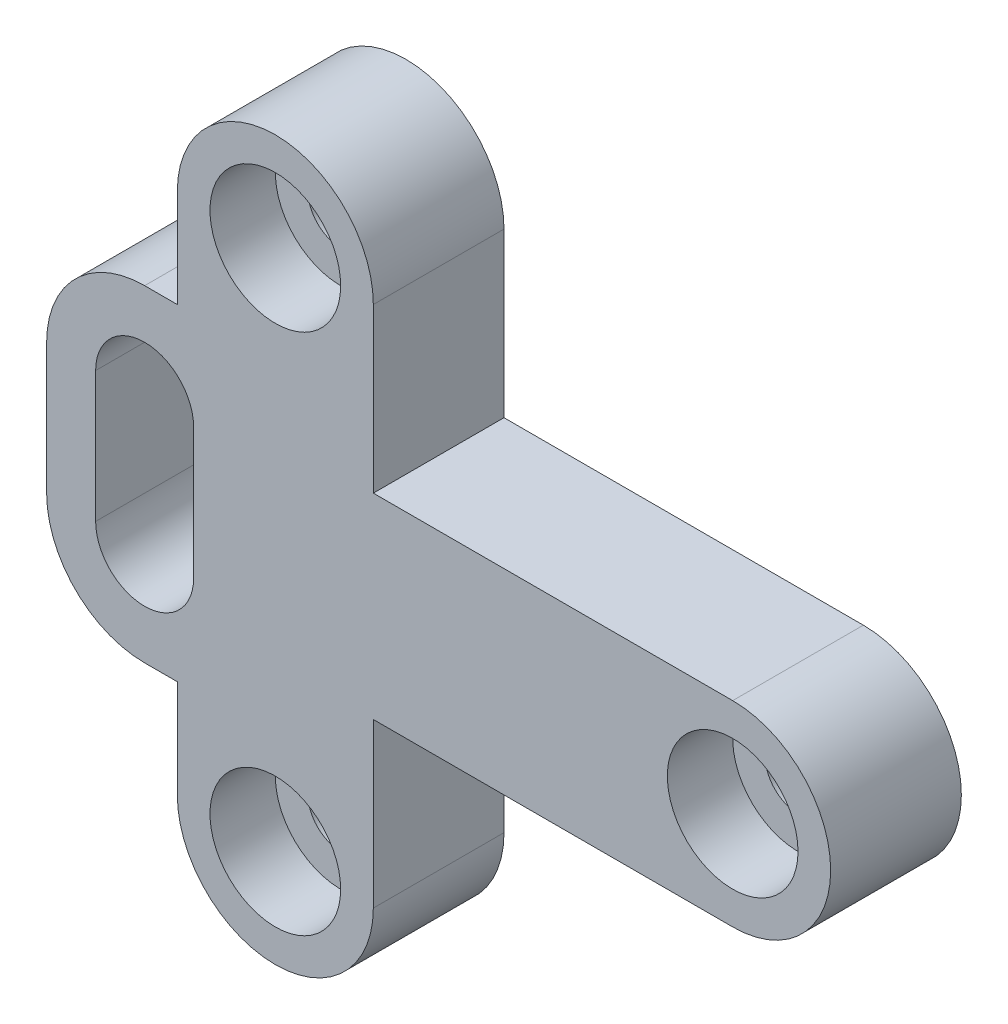
from build123d import *

# Parameters (mm, degrees)
IZIM1_R                     = 10
Y_KSEKLIK_EKSTR_ZYON1_DEPTH = 20
IZIM1_3_R                   = 10
IZIM1_3_R_2                 = 5
Y_KSEKLIK_EKSTR_ZYON2_DEPTH = 10


with BuildPart() as part:
    # Çizim1 → Yükseklik-Ekstrüzyon1 (new body)
    with BuildSketch(Plane.XY):
        with BuildLine():
            Line((15.000607379, -40), (15.000607379, -15))
            Line((15.000607379, -15), (70.000607379, -15))
            ThreePointArc((70.000607379, -15), (85.000607379, 0), (70.000607379, 15))
            Line((70.000607379, 15), (15.000607379, 15))
            Line((15.000607379, 15), (15.000607379, 40))
            ThreePointArc((15.000607379, 40), (0.000607379, 55), (-14.999392621, 40))
            Line((-14.999392621, 40), (-14.999392621, 28.684816199))
            Line((-14.999392621, 28.684816199), (-14.999392621, 25))
            Line((-14.999392621, 25), (-20, 25))
            ThreePointArc((-20, 25), (-30.606601718, 20.606601718), (-35, 10))
            Line((-35, 10), (-35, -10))
            ThreePointArc((-35, -10), (-30.606601718, -20.606601718), (-20, -25))
            Line((-20, -25), (-14.999392621, -25))
            Line((-14.999392621, -25), (-14.999392621, -40))
            ThreePointArc((-14.999392621, -40), (0.000607379, -55), (15.000607379, -40))
        make_face()
        with Locations((0.000607379, -40)):
            Circle(IZIM1_R, mode=Mode.SUBTRACT)
        with BuildLine():
            ThreePointArc((-27.5, 10), (-20, 17.5), (-12.5, 10))
            Line((-12.5, 10), (-12.5, -10))
            ThreePointArc((-12.5, -10), (-20, -17.5), (-27.5, -10))
            Line((-27.5, -10), (-27.5, 10))
        make_face(mode=Mode.SUBTRACT)
        with Locations((0.000607379, 40)):
            Circle(IZIM1_R, mode=Mode.SUBTRACT)
        with Locations((70.000607379, 0)):
            Circle(IZIM1_R, mode=Mode.SUBTRACT)
    extrude(amount=Y_KSEKLIK_EKSTR_ZYON1_DEPTH)

    # Çizim1<3> → Yükseklik-Ekstrüzyon2 (add)
    # profile 1 of 3: a face of its own
    with BuildSketch(Plane.XY):
        with Locations((0.000607379, -40)):
            Circle(IZIM1_3_R)
        with Locations((0.000607379, -40)):
            Circle(IZIM1_3_R_2, mode=Mode.SUBTRACT)
    # profile 2 of 3: a face of its own
    with BuildSketch(Plane.XY):
        with Locations((0.000607379, 40)):
            Circle(IZIM1_3_R)
        with Locations((0.000607379, 40)):
            Circle(IZIM1_3_R_2, mode=Mode.SUBTRACT)
    # profile 3 of 3: a face of its own
    with BuildSketch(Plane.XY):
        with Locations((70.000607379, 0)):
            Circle(IZIM1_3_R)
        with Locations((70.000607379, 0)):
            Circle(IZIM1_3_R_2, mode=Mode.SUBTRACT)
    extrude(amount=Y_KSEKLIK_EKSTR_ZYON2_DEPTH)


solid = part.part
